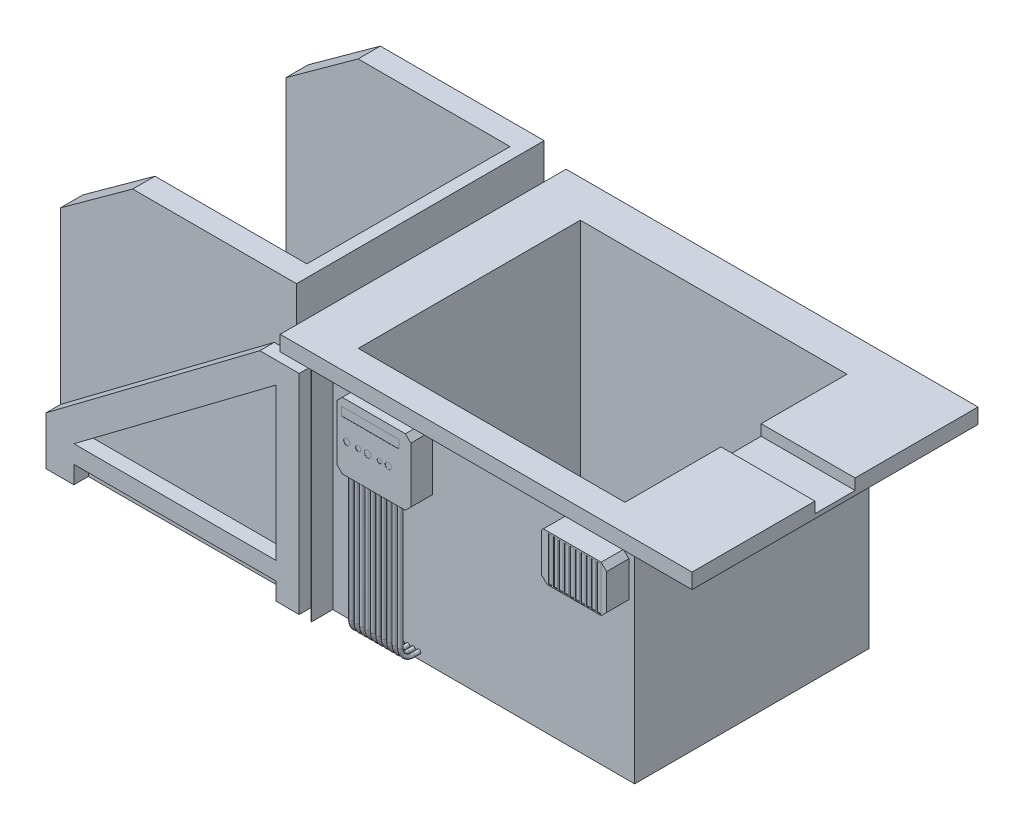
from build123d import *

# Parameters (mm, degrees)
SALIENTE_EXTRUIR1_DEPTH   = 1530
SALIENTE_EXTRUIR1_2_DEPTH = 1530
CROQUIS2_W                = 1475.310914845
CROQUIS2_H                = 1228.01442227
CORTAR_EXTRUIR1_DEPTH     = 1282
CROQUIS3_W                = 116.521976971
CROQUIS3_H                = 1232
CORTAR_EXTRUIR2_DEPTH     = 1670
SALIENTE_EXTRUIR2_DEPTH   = 123
CROQUIS5_W                = 21.756372831
CROQUIS5_H                = 241.737475897
CORTAR_EXTRUIR3_DEPTH     = 3
MATRIZL1_COUNT            = 10
MATRIZL1_PITCH            = 30
SALIENTE_EXTRUIR3_DEPTH   = 119
CROQUIS7_R                = 17.431476175
CROQUIS7_R_2              = 14.947367505
CROQUIS7_R_3              = 19.024892863
CROQUIS7_R_4              = 12.754803574
CROQUIS7_R_5              = 17.26441701
CROQUIS7_W                = 317.081547714
CROQUIS7_H                = 46.505293665
CORTAR_EXTRUIR4_DEPTH     = 1
CROQUIS8_R                = 11.171369709
MATRIZL2_COUNT            = 10
MATRIZL2_PITCH            = 30
CORTAR_EXTRUIR5_DEPTH     = 80
CORTAR_EXTRUIR6_DEPTH     = 80
CROQUIS11_W               = 1124.01793156
CROQUIS11_H               = 1303.309135367
CORTAR_EXTRUIR7_DEPTH     = 1240
CROQUIS12_W               = 1383.246748846
CROQUIS12_H               = 33.255283232
CORTAR_EXTRUIR8_DEPTH     = 5
CROQUIS13_W               = 1530
CROQUIS13_H               = 84.136069589
CORTAR_EXTRUIR9_DEPTH     = 174.12
CROQUIS14_W               = 519.636370287
CROQUIS14_H               = 222.080157184
CORTAR_EXTRUIR10_DEPTH    = 60.12
CROQUIS15_W               = 2278.642931789
CROQUIS15_H               = 26
SALIENTE_EXTRUIR4_DEPTH   = 84.12


with BuildPart() as part:
    # Croquis1 → Saliente-Extruir1 (new body)
    with BuildSketch(Plane.XY):
        Polygon((-486.33355551, -748), (-486.33355551, 440.415693177), (-581.059212975, 440.415693177), (-581.059212975, 750), (-1487.369887572, 750), (-1887.059212975, 460.427145535), (-1887.059212975, -750), align=None)
    extrude(amount=-SALIENTE_EXTRUIR1_DEPTH)

    # Croquis9 → Cortar-Extruir5 (cut)
    with BuildSketch(Plane.XY):
        Polygon((-1732.790068351, -552.811756881), (-614.21482022, -552.811756881), (-614.21482022, 287.720738961), align=None)
        Polygon((-704.044045057, 407.264894552), (-486.33355551, 407.264894552), (-486.33355551, 440.415693177), (-581.059212975, 440.415693177), (-581.059212975, 750), (-1487.369887572, 750), (-1887.059212975, 460.427145535), (-1887.059212975, -481.689776463), align=None)
        Polygon((-1732.790068351, -749.77972968), (-614.21482022, -748.182592878), (-614.21482022, -651.29574328), (-1732.790068351, -651.29574328), align=None)
    extrude(amount=-CORTAR_EXTRUIR5_DEPTH, mode=Mode.SUBTRACT)

    # Croquis10 → Cortar-Extruir6 (cut)
    with BuildSketch(Plane(origin=(0, 0, -1530), x_dir=(-1, 0, 0), z_dir=(0, 0, -1))):
        Polygon((614.21482022, -552.811756881), (614.21482022, 287.720738961), (1732.790068351, -552.811756881), align=None)
        Polygon((614.21482022, -651.29574328), (614.21482022, -748.182592878), (1732.790068351, -749.77972968), (1732.790068351, -651.29574328), align=None)
        Polygon((486.33355551, 407.264894552), (486.33355551, 440.415693177), (581.059212975, 440.415693177), (581.059212975, 750), (1487.369887572, 750), (1887.059212975, 460.427145535), (1887.059212975, -481.689776463), (704.044045057, 407.264894552), align=None)
    extrude(amount=-CORTAR_EXTRUIR6_DEPTH, mode=Mode.SUBTRACT)

    # Croquis11 → Cortar-Extruir7 (cut)
    with BuildSketch(Plane.ZY.offset(1887.059212975)):
        with Locations((-765.208896251, 206.874465931)):
            Rectangle(CROQUIS11_W, CROQUIS11_H)
    extrude(amount=-CORTAR_EXTRUIR7_DEPTH, mode=Mode.SUBTRACT)

    # Croquis12 → Cortar-Extruir8 (cut)
    with BuildSketch(Plane.ZY.offset(1887.059212975)):
        with Locations((-765, -530.421767555)):
            Rectangle(CROQUIS12_W, CROQUIS12_H)
    extrude(amount=-CORTAR_EXTRUIR8_DEPTH, mode=Mode.SUBTRACT)


with BuildPart() as body_2:
    # Croquis1 → Saliente-Extruir1 2 (new body)
    with BuildSketch(Plane.XY):
        Polygon((-420.473883998, -748), (1252.999400231, -748), (1252.999400231, 484), (1887.059212975, 484), (1887.059212975, 568.136069589), (-565.703718814, 568.136069589), (-565.703718814, 491.784423999), (-420.473883998, 491.784423999), align=None)
    extrude(amount=-SALIENTE_EXTRUIR1_2_DEPTH)

    # Croquis2 → Cortar-Extruir1 (cut)
    with BuildSketch(Plane(origin=(0, 568.136069589, 0), x_dir=(1, 0, 0), z_dir=(0, 1, 0))):
        with Locations((455.647385266, 736.706723235)):
            Rectangle(CROQUIS2_W, CROQUIS2_H)
    extrude(amount=-CORTAR_EXTRUIR1_DEPTH, mode=Mode.SUBTRACT)

    # Croquis3 → Cortar-Extruir2 (cut)
    with BuildSketch(Plane(origin=(1252.999400231, 0, 0), x_dir=(0, 0, -1), z_dir=(1, 0, 0))):
        with Locations((58.260988486, -132)):
            Rectangle(CROQUIS3_W, CROQUIS3_H)
        with Locations((1471.739011514, -132)):
            Rectangle(CROQUIS3_W, CROQUIS3_H)
    extrude(amount=-CORTAR_EXTRUIR2_DEPTH, mode=Mode.SUBTRACT)

    # Croquis4 → Saliente-Extruir2 (add)
    with BuildSketch(Plane.XY.offset(-116.521976971)):
        Polygon((861.076878714, 334.685821772), (871.076878714, 344.685821772), (1190.85745714, 344.685821772), (1220.85745714, 314.685821772), (1220.85745714, 118.511695315), (1190.85745714, 88.511695315), (891.076878714, 88.511695315), (861.076878714, 118.511695315), align=None)
    extrude(amount=SALIENTE_EXTRUIR2_DEPTH)

    # Croquis5 → Cortar-Extruir3 (cut)
    with BuildSketch(Plane.XY.offset(6.478023029)):
        with Locations((909.144555717, 215.10623895)):
            Rectangle(CROQUIS5_W, CROQUIS5_H)
    cortar_extruir3 = extrude(amount=-CORTAR_EXTRUIR3_DEPTH, mode=Mode.SUBTRACT)

    # MatrizL1: Cortar-Extruir3 ×10
    with Locations(*[(i * MATRIZL1_PITCH, 0, 0) for i in range(1, MATRIZL1_COUNT)]):
        add(cortar_extruir3, mode=Mode.SUBTRACT)

    # Croquis6 → Saliente-Extruir3 (add)
    with BuildSketch(Plane.XY.offset(-116.521976971)):
        Polygon((-275.508352868, 384.380423932), (-245.508352868, 414.380423932), (103.649882135, 414.380423932), (133.649882135, 384.380423932), (133.649882135, 77.842838409), (103.649882135, 47.842838409), (-245.508352868, 47.842838409), (-275.508352868, 77.842838409), align=None)
    extrude(amount=SALIENTE_EXTRUIR3_DEPTH)

    # Croquis7 → Cortar-Extruir4 (cut)
    with BuildSketch(Plane.XY.offset(2.478023029)):
        with Locations((-220.581157949, 212.950068835)):
            Circle(CROQUIS7_R)
        with Locations((-157.164848406, 212.950068835)):
            Circle(CROQUIS7_R_2)
        with Locations((-104.317923787, 212.950068835)):
            Circle(CROQUIS7_R_3)
        with Locations((-39.445355172, 212.950068835)):
            Circle(CROQUIS7_R_4)
        with Locations((8.708750026, 212.950068835)):
            Circle(CROQUIS7_R_5)
        with Locations((-91.634661878, 346.124318876)):
            Rectangle(CROQUIS7_W, CROQUIS7_H)
    extrude(amount=-CORTAR_EXTRUIR4_DEPTH, mode=Mode.SUBTRACT)

    # Barrer1: sweep along a curve in space
    with BuildLine() as barrer1_path:
        Line((-211.20824484, 47.842838409, -14.136176206), (-211.20824484, -640.365328852, -14.136176206))
        ThreePointArc((-211.20824484, -640.365328852, -14.136176206), (-211.20824484, -689.862803535, -34.638701523), (-211.20824484, -710.365328852, -84.136176206))
        Line((-211.20824484, -710.365328852, -84.136176206), (-211.20824484, -710.365328852, -131.329146561))
    # Croquis8 → Barrer1 (sweep)
    with BuildSketch(Plane.XZ.offset(-47.842838409)):
        with Locations((-211.20824484, -14.136176206)):
            Circle(CROQUIS8_R)
    barrer1 = sweep(path=barrer1_path.line)

    # MatrizL2: Barrer1 ×10
    with Locations(*[(i * MATRIZL2_PITCH, 0, 0) for i in range(1, MATRIZL2_COUNT)]):
        add(barrer1)

    # Croquis13 → Cortar-Extruir9 (cut)
    with BuildSketch(Plane(origin=(1887.059212975, 0, 0), x_dir=(0, 0, -1), z_dir=(1, 0, 0))):
        with Locations((765, 526.068034795)):
            Rectangle(CROQUIS13_W, CROQUIS13_H)
    extrude(amount=-CORTAR_EXTRUIR9_DEPTH, mode=Mode.SUBTRACT)

    # Croquis14 → Cortar-Extruir10 (cut)
    with BuildSketch(Plane(origin=(0, 568.136069589, 0), x_dir=(1, 0, 0), z_dir=(0, 1, 0))):
        with Locations((1453.121027832, 765)):
            Rectangle(CROQUIS14_W, CROQUIS14_H)
    extrude(amount=-CORTAR_EXTRUIR10_DEPTH, mode=Mode.SUBTRACT)

    # Croquis15 → Saliente-Extruir4 (add)
    with BuildSketch(Plane(origin=(0, 568.136069589, 0), x_dir=(1, 0, 0), z_dir=(0, 1, 0))):
        with Locations((573.617747081, -13)):
            Rectangle(CROQUIS15_W, CROQUIS15_H)
        with Locations((573.617747081, 1543)):
            Rectangle(CROQUIS15_W, CROQUIS15_H)
    extrude(amount=-SALIENTE_EXTRUIR4_DEPTH)


solid = Compound([part.part, body_2.part])
